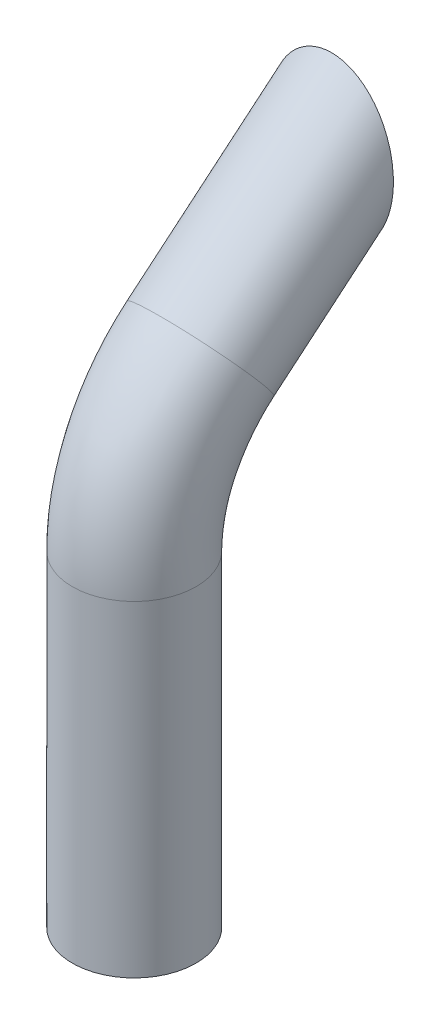
from build123d import *

# Parameters (mm, degrees)
SKETCH2_R          = 30
SKETCH2_R_2        = 27
SKETCH3_W          = 78.072934237
SKETCH3_H          = 102.462718997
CUT_EXTRUDE1_DEPTH = 129


with BuildPart() as part:
    # Sweep-Thin1: sweep along a path in Sketch1
    with BuildLine(Plane(origin=(0, 0, 0), x_dir=(0, 0, -1), z_dir=(1, 0, 0))) as sweep_thin1_path:
        Line((0, 0), (-82.75755134, -69.441830806))
        ThreePointArc((-82.75755134, -69.441830806), (-106.474367301, -100.35018713), (-114.906666468, -138.385830687))
        Line((-114.906666468, -138.385830687), (-114.906666468, -296.418141453))
    # Sketch2 → Sweep-Thin1 (sweep)
    with BuildSketch(Plane(origin=(0, 0, 0), x_dir=(1, 0, 0), z_dir=(0, -0.642787609686538, 0.7660444431189792))):
        Circle(SKETCH2_R)
        Circle(SKETCH2_R_2, mode=Mode.SUBTRACT)
    sweep(path=sweep_thin1_path.line)

    # Sketch3 → Cut-Extrude1 (cut, symmetric)
    with BuildSketch(Plane(origin=(0, 0, 0), x_dir=(0, 0, -1), z_dir=(1, 0, 0))):
        with Locations((19.752838827, -28.250026204)):
            Rectangle(SKETCH3_W, SKETCH3_H)
    extrude(amount=CUT_EXTRUDE1_DEPTH, both=True, mode=Mode.SUBTRACT)


solid = part.part
